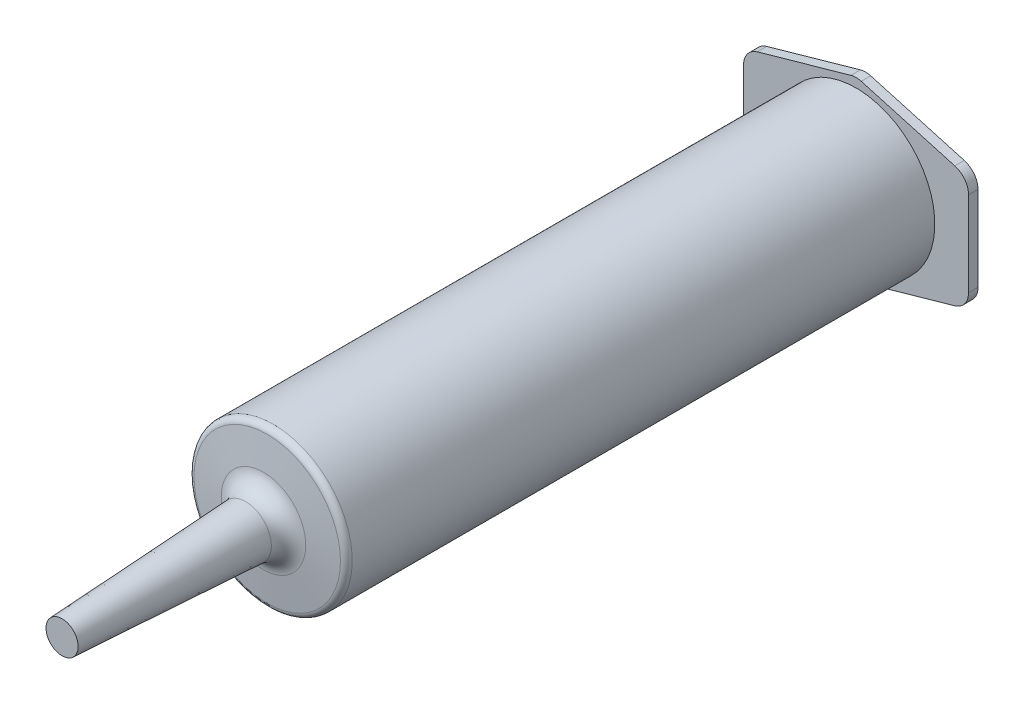
from build123d import *

# Parameters (mm, degrees)
FILLET1_R           = 3.81
SHELL1_T            = -1.905
BOSS_EXTRUDE1_START = -1.905
SKETCH2_R           = 15.875
BOSS_EXTRUDE1_DEPTH = 1.905
FILLET2_R           = 3.81
FILLET3_R           = 1.27


with BuildPart() as part:
    # Sketch1 → Revolve1 (revolve)
    with BuildSketch(Plane(origin=(0, 0, 0), x_dir=(1, 0, 0), z_dir=(0, 1, 0))):
        Polygon((16.038285714, 117.815178571), (16.038285714, -2.631621429), (5.497285714, -3.901621429), (3.401785714, -44.109821429), (0.163285714, -44.109821429), (0.163285714, 117.815178571), align=None)
    revolve(axis=Axis((0.163285714, 0, 44.109821429), (0, 0, -1)))

    # Fillet1
    fillet1_edges = [part.edges().sort_by_distance(p)[0] for p in [
        (-5.170714286, 0, 3.901621429),
    ]]
    fillet(fillet1_edges, radius=FILLET1_R)

    # Shell1
    shell1_openings = [part.faces().sort_by_distance(p)[0] for p in [
        (0.163285714, 0, -117.815178571),
    ]]
    offset(amount=SHELL1_T, openings=shell1_openings, kind=Kind.INTERSECTION)

    # Sketch2 → Boss-Extrude1 (add)
    with BuildSketch(Plane(origin=(0, 0, -117.815178571), x_dir=(-1, 0, 0), z_dir=(0, 0, -1)).offset(BOSS_EXTRUDE1_START)):
        Polygon((-0.163285714, 17.8435), (22.506214286, 11.43), (22.506214286, -11.43), (-0.163285714, -17.8435), (-22.832785714, -11.43), (-22.832785714, 11.43), align=None)
        with Locations((-0.163285714, 0)):
            Circle(SKETCH2_R, mode=Mode.SUBTRACT)
    extrude(amount=BOSS_EXTRUDE1_DEPTH)

    # Fillet2
    fillet2_edges = [part.edges().sort_by_distance(p)[0] for p in [
        (0.163285714, 17.8435, -116.862678571),
        (-22.506214286, 11.43, -116.862678571),
        (-22.506214286, -11.43, -116.862678571),
        (0.163285714, -17.8435, -116.862678571),
        (22.832785714, -11.43, -116.862678571),
        (22.832785714, 11.43, -116.862678571),
    ]]
    fillet(fillet2_edges, radius=FILLET2_R)

    # Fillet3
    fillet3_edges = [part.edges().sort_by_distance(p)[0] for p in [
        (-15.711714286, 0, 2.631621429),
    ]]
    fillet(fillet3_edges, radius=FILLET3_R)


solid = part.part
